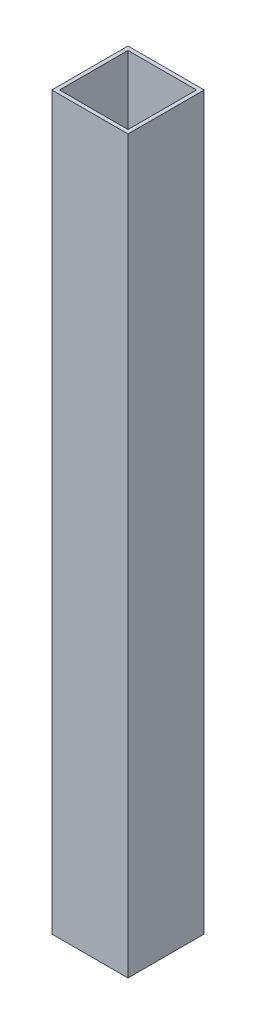
from build123d import *

# Parameters (mm, degrees)
SKETCH1_W           = 31.75
SKETCH1_H           = 31.75
SKETCH1_W_2         = 28.575
SKETCH1_H_2         = 28.575
BOSS_EXTRUDE1_DEPTH = 304.8


with BuildPart() as part:
    # Sketch1 → Boss-Extrude1 (new body)
    with BuildSketch(Plane(origin=(0, 0, 0), x_dir=(1, 0, 0), z_dir=(0, 1, 0))):
        Rectangle(SKETCH1_W, SKETCH1_H)
        Rectangle(SKETCH1_W_2, SKETCH1_H_2, mode=Mode.SUBTRACT)
    extrude(amount=BOSS_EXTRUDE1_DEPTH)


solid = part.part
